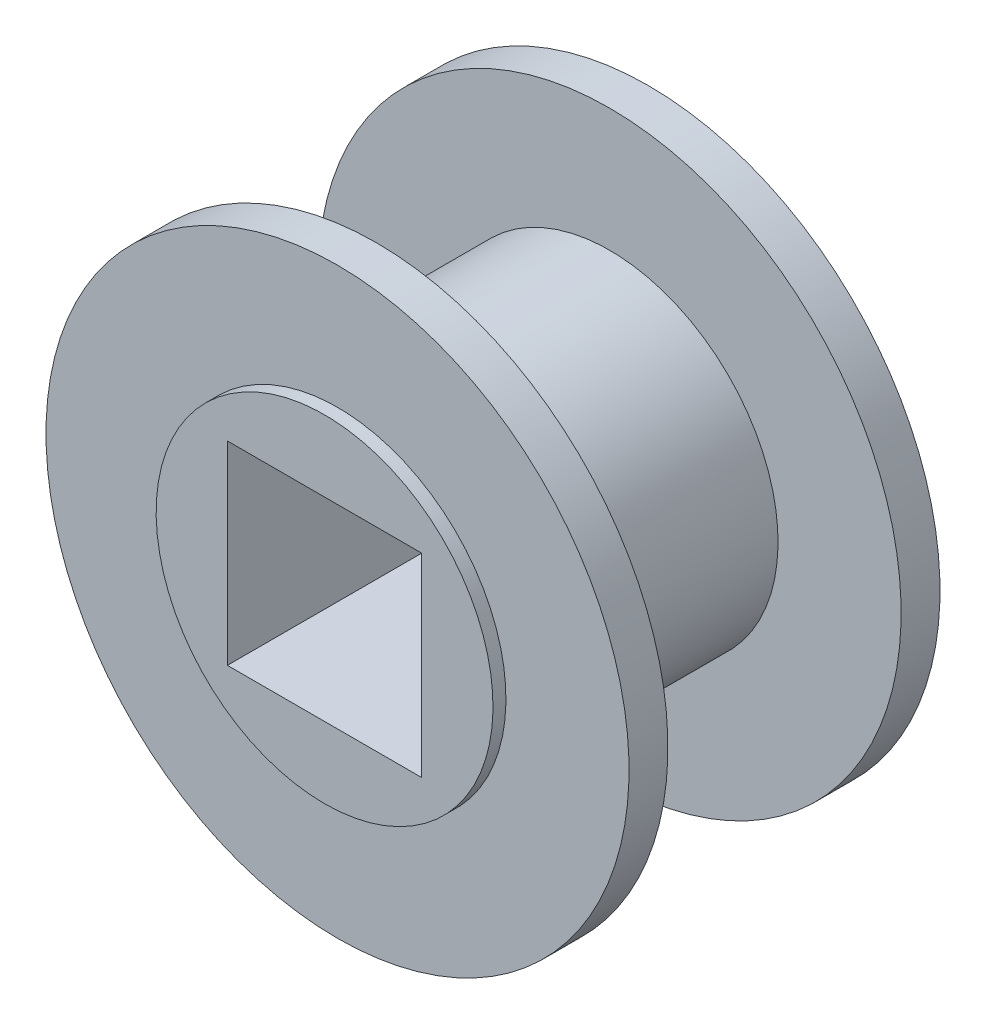
from build123d import *

# Parameters (mm, degrees)
SCHIZZO2_W                    = 15
SCHIZZO2_H                    = 15
TAGLIO_ESTRUSIONE1_DEPTH      = 42.091361623
TAGLIO_ESTRUSIONE2_REACH      = 36.373
TAGLIO_ESTRUSIONE2_END_RADIUS = 13
SCHIZZO3_R                    = 1.5


with BuildPart() as part:
    # Schizzo1 → Rivoluzione1 (revolve)
    with BuildSketch(Plane(origin=(0, 0, 0), x_dir=(0, 0, -1), z_dir=(1, 0, 0)), mode=Mode.PRIVATE) as rivoluzione1_sk:
        Polygon((-13, 0), (-13, 13), (-12, 13), (-12, 22.5), (-9, 22.5), (-9, 13), (9, 13), (9, 22.5), (12, 22.5), (12, 13), (13, 13), (13, 0), align=None)
    revolve(rivoluzione1_sk.sketch.rotate(Axis((0, 0, 19.581761006), (0, 0, -1)), 180), axis=Axis((0, 0, 19.581761006), (0, 0, -1)))

    # Schizzo2 → Taglio-Estrusione1 (cut, through all)
    with BuildSketch(Plane.XY.offset(13)):
        Rectangle(SCHIZZO2_W, SCHIZZO2_H)
    extrude(amount=-TAGLIO_ESTRUSIONE1_DEPTH, mode=Mode.SUBTRACT)

    # Taglio-Estrusione2: up to this cylinder (the profile starts inside it)
    taglio_estrusione2_end = Plane(origin=(0, 0, -7), z_dir=(0, 0, 1)) * Cylinder(TAGLIO_ESTRUSIONE2_END_RADIUS, 99.746, mode=Mode.PRIVATE)
    # Schizzo3 → Taglio-Estrusione2 (cut, up to the surface)
    with BuildSketch(Plane(origin=(0, 0, 0), x_dir=(0, 0, -1), z_dir=(1, 0, 0)), mode=Mode.PRIVATE) as taglio_estrusione2_sk1:
        with Locations((7, 0)):
            Circle(SCHIZZO3_R)
    taglio_estrusione2_tool1 = extrude(taglio_estrusione2_sk1.sketch, amount=-TAGLIO_ESTRUSIONE2_REACH, mode=Mode.PRIVATE) & taglio_estrusione2_end
    add(taglio_estrusione2_tool1.solids().sort_by_distance((0, 0, -7))[0], mode=Mode.SUBTRACT)


solid = part.part
